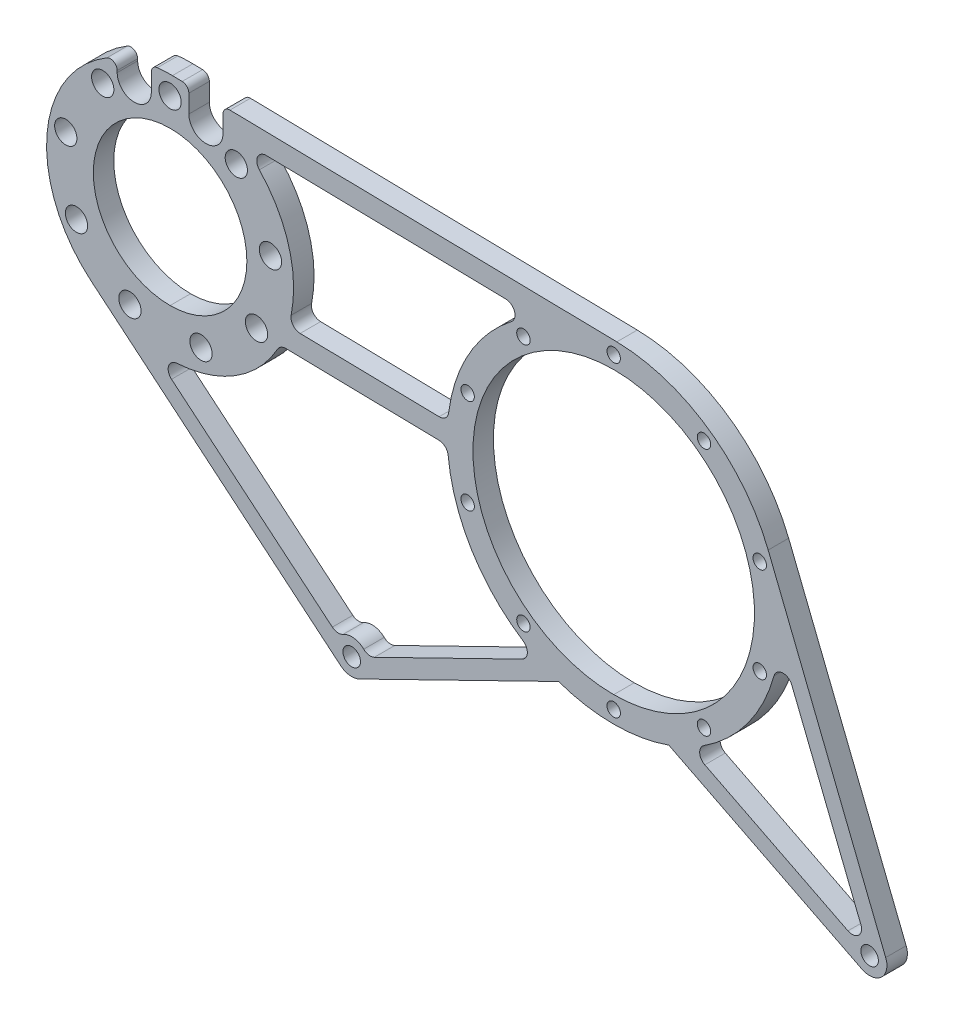
from build123d import *

# Parameters (mm, degrees)
SKETCH2_R               = 28.575
SKETCH2_R_2             = 3.2639
SKETCH2_R_3             = 52.3875
BOSS_EXTRUDE1_DEPTH     = 7.62
CUT_EXTRUDE1_DEPTH      = 369.573342704
CUT_EXTRUDE1_DEPTH_BACK = 369.573342704
SKETCH3_R               = 4.15
SKETCH3_R_2             = 2.5
CUT_EXTRUDE2_DEPTH      = 369.573342704
CUT_EXTRUDE2_DEPTH_BACK = 369.573342704


with BuildPart() as part:
    # Sketch2 → Boss-Extrude1 (new body)
    with BuildSketch(Plane.XY):
        with BuildLine():
            Line((-308.866129262, 91.710399516), (-215.926365234, 14.107506231))
            ThreePointArc((-215.926365234, 14.107506231), (-212.572921228, 12.657721799), (-208.970475069, 13.265869211))
            Line((-208.970475069, 13.265869211), (-134.814952137, 49.535152614))
            ThreePointArc((-134.814952137, 49.535152614), (-114.3, 46.0375), (-93.785047863, 49.535152614))
            Line((-93.785047863, 49.535152614), (-21.949808906, 13.301039962))
            ThreePointArc((-21.949808906, 13.301039962), (-14.699565425, 14.303090245), (-13.070560605, 21.438668609))
            Line((-13.070560605, 21.438668609), (-56.805390428, 130.917967399))
            ThreePointArc((-56.805390428, 130.917967399), (-79.09759936, 158.880822155), (-113.13445351, 169.85152791))
            Line((-113.13445351, 169.85152791), (-257.123397092, 172.562701825))
            ThreePointArc((-257.123397092, 172.562701825), (-258.950279318, 171.836030325), (-259.711214384, 170.023151962))
            Line((-259.711214384, 170.023151962), (-259.711214384, 163.648011794))
            ThreePointArc((-259.711214384, 163.648011794), (-266.061214384, 157.298011794), (-272.411214384, 163.648011794))
            Line((-272.411214384, 163.648011794), (-272.411214384, 170.357932335))
            ThreePointArc((-272.411214384, 170.357932335), (-273.138336021, 172.136997269), (-274.903397092, 172.897482198))
            Line((-274.903397092, 172.897482198), (-278.534507017, 172.96585252))
            ThreePointArc((-278.534507017, 172.96585252), (-281.325275441, 172.933669465), (-284.108948518, 172.732203969))
            ThreePointArc((-284.108948518, 172.732203969), (-285.734576401, 171.907148337), (-286.388785616, 170.205562866))
            Line((-286.388785616, 170.205562866), (-286.388785616, 163.648011794))
            ThreePointArc((-286.388785616, 163.648011794), (-292.738785616, 157.298011794), (-299.088785616, 163.648011794))
            Line((-299.088785616, 163.648011794), (-299.088785616, 164.31478857))
            ThreePointArc((-299.088785616, 164.31478857), (-300.373839326, 166.523115948), (-302.928714599, 166.496939949))
            ThreePointArc((-302.928714599, 166.496939949), (-325.229794091, 130.638495508), (-308.866129262, 91.710399516))
        make_face()
        with Locations(Location((-279.4, 127, 0), (0, 0, 180))):
            Circle(SKETCH2_R, mode=Mode.SUBTRACT)
        with Locations(Location((-19.05, 19.05, 0), (0, 0, 180))):
            Circle(SKETCH2_R_2, mode=Mode.SUBTRACT)
        with Locations(Location((-211.799479175, 19.05, 0), (0, 0, 180))):
            Circle(SKETCH2_R_2, mode=Mode.SUBTRACT)
        with Locations(Location((-114.3, 107.95, 0), (0, 0, 180))):
            Circle(SKETCH2_R_3, mode=Mode.SUBTRACT)
    extrude(amount=BOSS_EXTRUDE1_DEPTH)

    # Sketch3 → Cut-Extrude1 (cut, two sides: drawn at the far end of the back side and taken through both)
    with BuildSketch(Plane.XY.offset(7.62).offset(-CUT_EXTRUDE1_DEPTH_BACK)):
        with Locations((-279.4, 166.00043)):
            Circle(SKETCH3_R)
        with Locations((-254.746524018, 156.380868571)):
            Circle(SKETCH3_R)
        with Locations((-242.044200635, 133.164908097)):
            Circle(SKETCH3_R)
        with Locations((-247.236588134, 107.215554499)):
            Circle(SKETCH3_R)
        with Locations((-267.894110695, 90.674798722)):
            Circle(SKETCH3_R)
        with Locations((-294.35088393, 91.282244222)):
            Circle(SKETCH3_R)
        with Locations((-314.227489609, 108.753660501)):
            Circle(SKETCH3_R)
        with Locations((-318.223443029, 134.913977707)):
            Circle(SKETCH3_R)
        with Locations((-304.468993176, 157.522492681)):
            Circle(SKETCH3_R)
        with Locations((-114.3, 165.1)):
            Circle(SKETCH3_R_2)
        with Locations((-80.708072831, 154.185321229)):
            Circle(SKETCH3_R_2)
        with Locations((-59.947120094, 125.610321229)):
            Circle(SKETCH3_R_2)
        with Locations((-59.947120094, 90.289678771)):
            Circle(SKETCH3_R_2)
        with Locations((-80.708072831, 61.714678771)):
            Circle(SKETCH3_R_2)
        with Locations((-114.3, 50.8)):
            Circle(SKETCH3_R_2)
        with Locations((-147.891927169, 61.714678771)):
            Circle(SKETCH3_R_2)
        with Locations((-168.652879906, 90.289678771)):
            Circle(SKETCH3_R_2)
        with Locations((-168.652879906, 125.610321229)):
            Circle(SKETCH3_R_2)
        with Locations((-147.891927169, 154.185321229)):
            Circle(SKETCH3_R_2)
    extrude(amount=CUT_EXTRUDE1_DEPTH + CUT_EXTRUDE1_DEPTH_BACK, mode=Mode.SUBTRACT)

    # Sketch4 → Cut-Extrude2 (cut, two sides: drawn at the far end of the back side and taken through both)
    with BuildSketch(Plane.XY.offset(7.62).offset(-CUT_EXTRUDE2_DEPTH_BACK)):
        with BuildLine():
            Line((-278.862624236, 74.930604639), (-219.018129111, 24.961616472))
            ThreePointArc((-219.018129111, 24.961616472), (-217.07692299, 24.16262829), (-215.028330647, 24.620812453))
            ThreePointArc((-215.028330647, 24.620812453), (-211.026037121, 25.442278201), (-207.335161059, 23.689967346))
            ThreePointArc((-207.335161059, 23.689967346), (-205.454963796, 22.756414152), (-203.379217054, 23.069365873))
            Line((-203.379217054, 23.069365873), (-148.393096208, 49.962941986))
            ThreePointArc((-148.393096208, 49.962941986), (-146.441473652, 52.888826728), (-148.025123052, 56.029158988))
            ThreePointArc((-148.025123052, 56.029158988), (-167.199986736, 75.782484405), (-175.915777896, 101.895780766))
            ThreePointArc((-175.915777896, 101.895780766), (-177.021567584, 104.119565425), (-179.32579095, 105.046141768))
            Line((-179.32579095, 105.046141768), (-236.289123771, 106.118706774))
            ThreePointArc((-236.289123771, 106.118706774), (-238.085307811, 105.660495116), (-239.394002214, 104.347653165))
            ThreePointArc((-239.394002214, 104.347653165), (-255.140570758, 87.947615069), (-276.820157686, 81.098441316))
            ThreePointArc((-276.820157686, 81.098441316), (-279.939618833, 78.709346862), (-278.862624236, 74.930604639))
        make_face()
        with BuildLine():
            Line((-48.019318761, 91.807143198), (-22.303873454, 27.434904147))
            ThreePointArc((-22.303873454, 27.434904147), (-23.187455951, 23.564521405), (-27.120033775, 23.021003007))
            Line((-27.120033775, 23.021003007), (-80.387932313, 49.889641079))
            ThreePointArc((-80.387932313, 49.889641079), (-82.302626367, 52.822384958), (-80.709884678, 55.941714036))
            ThreePointArc((-80.709884678, 55.941714036), (-64.405072396, 71.294115674), (-54.62867895, 91.442695545))
            ThreePointArc((-54.62867895, 91.442695545), (-51.454892751, 93.998716793), (-48.019318761, 91.807143198))
        make_face()
        with BuildLine():
            Line((-243.589870481, 164.686527829), (-154.467376545, 163.008436618))
            ThreePointArc((-154.467376545, 163.008436618), (-151.219977886, 160.621367905), (-152.384754551, 156.763001619))
            ThreePointArc((-152.384754551, 156.763001619), (-168.119955828, 138.553431359), (-175.723033577, 115.719723447))
            ThreePointArc((-175.723033577, 115.719723447), (-176.903269485, 113.516440978), (-179.253671427, 112.666134477))
            Line((-179.253671427, 112.666134477), (-230.993471474, 113.640345363))
            ThreePointArc((-230.993471474, 113.640345363), (-233.653099209, 114.948221132), (-234.350027257, 117.828924174))
            ThreePointArc((-234.350027257, 117.828924174), (-235.231792854, 139.758454197), (-246.179291838, 158.780390577))
            ThreePointArc((-246.179291838, 158.780390577), (-246.854206706, 162.596999998), (-243.589870481, 164.686527829))
        make_face()
    extrude(amount=CUT_EXTRUDE2_DEPTH + CUT_EXTRUDE2_DEPTH_BACK, mode=Mode.SUBTRACT)


solid = part.part
